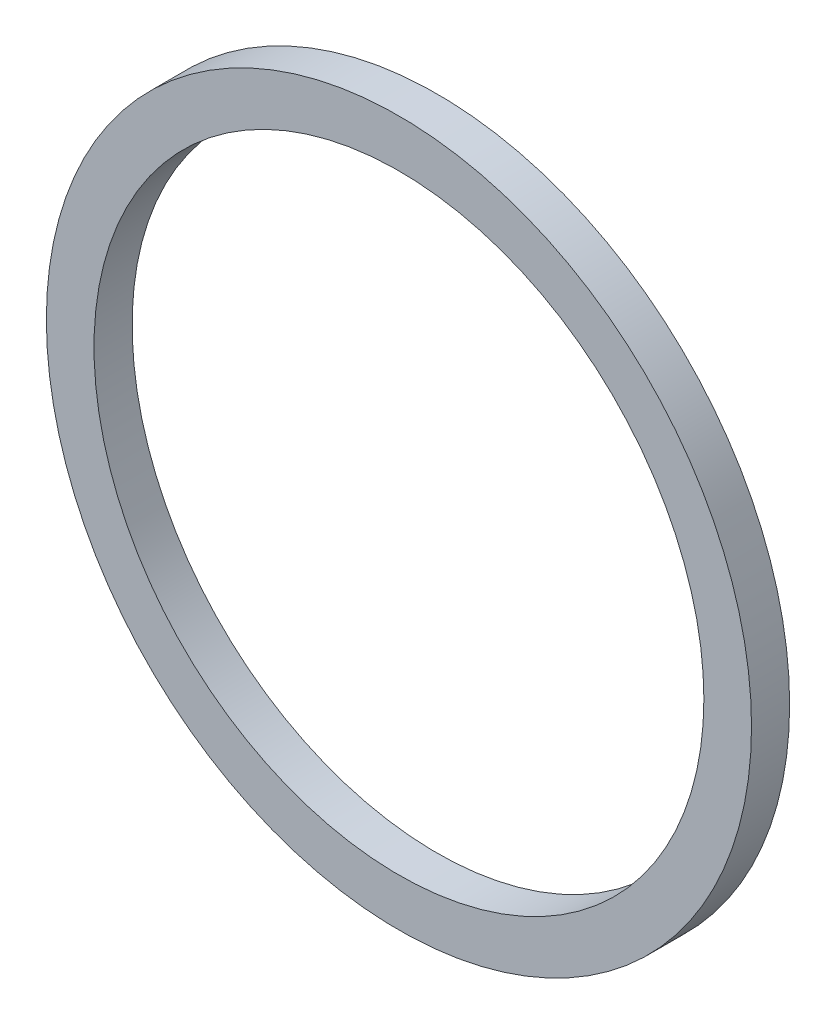
from build123d import *

# Parameters (mm, degrees)
SKETCH_1_R      = 3.7
SKETCH_1_R_2    = 3.2
EXTRUDE_1_DEPTH = 0.4


with BuildPart() as part:
    # 草图1 → 凸台-拉伸1 (new body)
    with BuildSketch(Plane.XY):
        Circle(SKETCH_1_R)
        Circle(SKETCH_1_R_2, mode=Mode.SUBTRACT)
    extrude(amount=EXTRUDE_1_DEPTH)


solid = part.part
